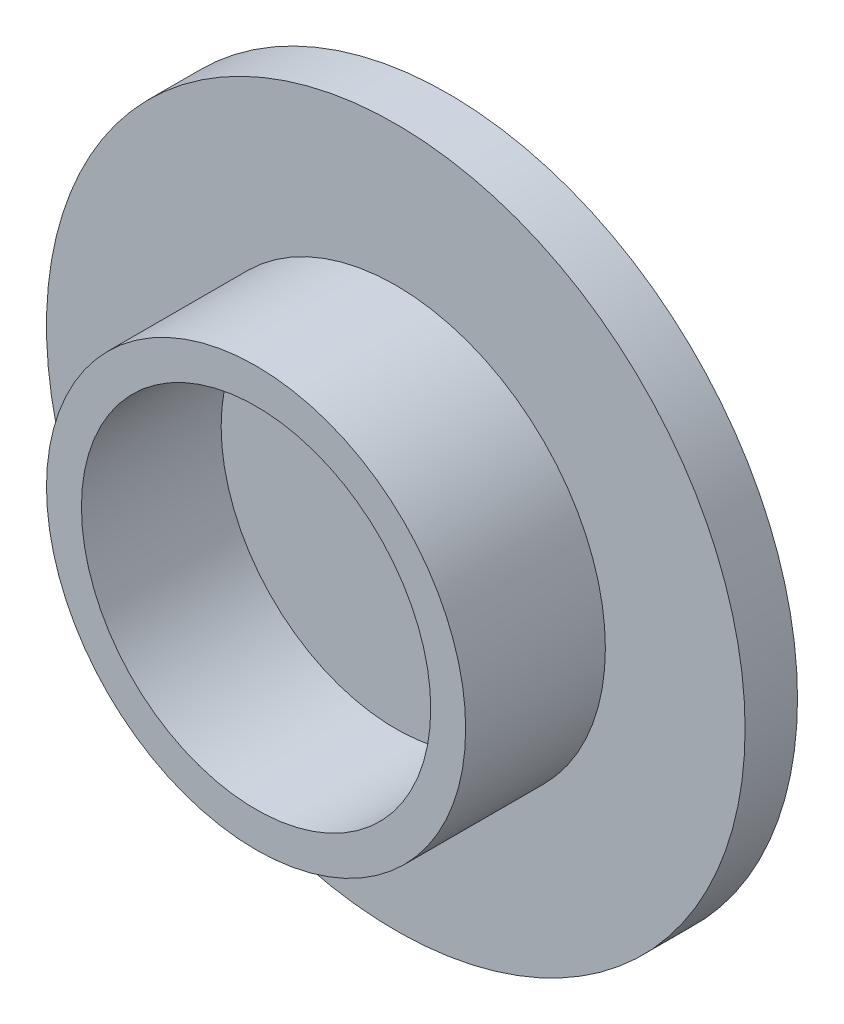
from build123d import *

# Parameters (mm, degrees)
SKETCH1_R           = 20
BOSS_EXTRUDE1_DEPTH = 3
SKETCH2_R           = 12
SKETCH2_R_2         = 10
BOSS_EXTRUDE2_DEPTH = 8


with BuildPart() as part:
    # Sketch1 → Boss-Extrude1 (new body)
    with BuildSketch(Plane.XY):
        Circle(SKETCH1_R)
    extrude(amount=BOSS_EXTRUDE1_DEPTH)

    # Sketch2 → Boss-Extrude2 (add)
    with BuildSketch(Plane.XY.offset(3)):
        Circle(SKETCH2_R)
        Circle(SKETCH2_R_2, mode=Mode.SUBTRACT)
    extrude(amount=BOSS_EXTRUDE2_DEPTH)


solid = part.part
